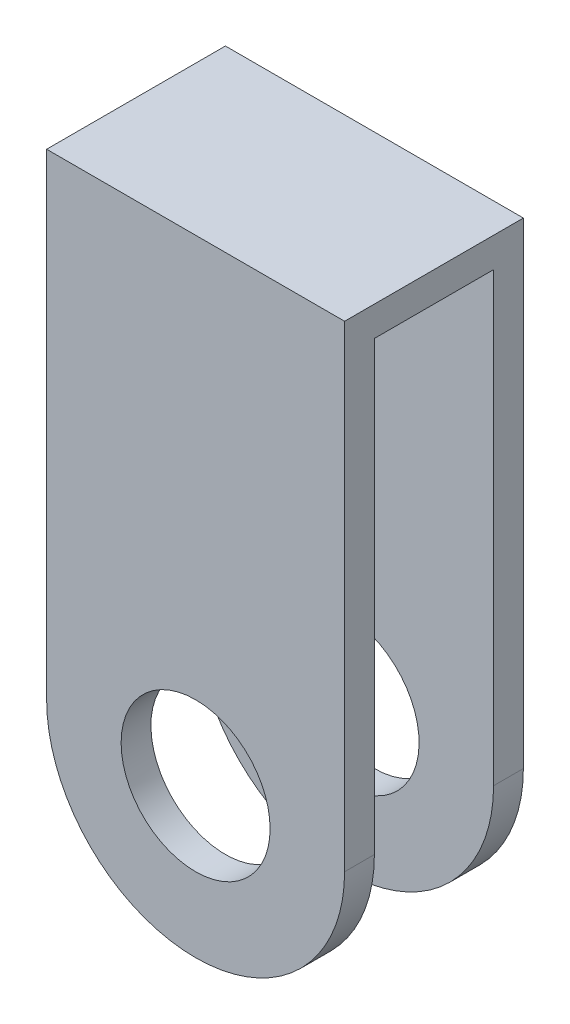
from build123d import *

# Parameters (mm, degrees)
SKETCH1_R           = 5
BOSS_EXTRUDE1_DEPTH = 12
CUT_EXTRUDE1_REACH  = 52.006
SKETCH2_W           = 8
SKETCH2_H           = 42.233489427


with BuildPart() as part:
    # Sketch1 → Boss-Extrude1 (new body)
    with BuildSketch(Plane.XY):
        with BuildLine():
            Line((-2.088637096, 12.233489427), (-2.088637096, 44.233489427))
            Line((-2.088637096, 44.233489427), (17.911362904, 44.233489427))
            Line((17.911362904, 44.233489427), (17.911362904, 12.233489427))
            ThreePointArc((17.911362904, 12.233489427), (7.911362904, 2.233489427), (-2.088637096, 12.233489427))
        make_face()
        with Locations((7.911362904, 12.233489427)):
            Circle(SKETCH1_R, mode=Mode.SUBTRACT)
    extrude(amount=BOSS_EXTRUDE1_DEPTH)

    # Cut-Extrude1: up to this face of the body (flat: up to its plane)
    cut_extrude1_end = Plane(part.part.faces().sort_by_distance((17.911362904, 28.233489427, 6))[0])
    # Sketch2 → Cut-Extrude1 (cut, up to the picked face)
    with BuildSketch(Plane.ZY.offset(2.088637096), mode=Mode.PRIVATE) as cut_extrude1_sk1:
        with Locations((6, 21.116744714)):
            Rectangle(SKETCH2_W, SKETCH2_H)
    cut_extrude1_tool1 = split(extrude(cut_extrude1_sk1.sketch, amount=-CUT_EXTRUDE1_REACH, mode=Mode.PRIVATE), bisect_by=cut_extrude1_end, keep=Keep.BOTH, mode=Mode.PRIVATE)
    add(cut_extrude1_tool1.solids().sort_by(Axis((-2.088637, 21.116745, 6), (1, 0, 0)))[0], mode=Mode.SUBTRACT)


solid = part.part
